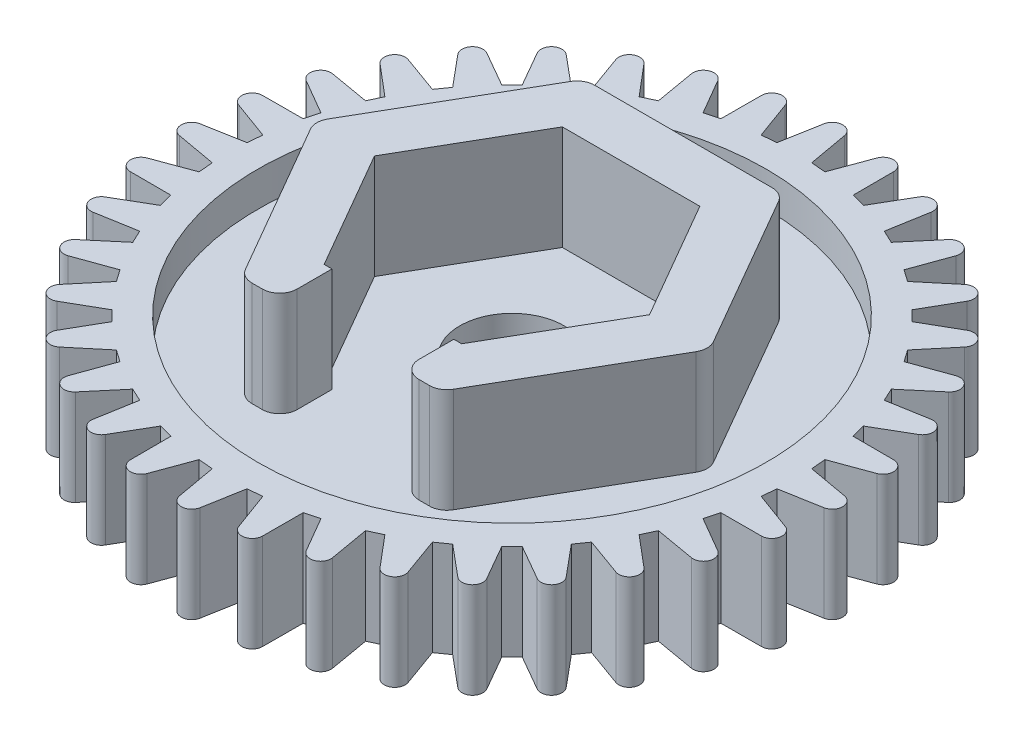
from build123d import *

# Parameters (mm, degrees)
SKETCH2_R           = 13.435028843
CUT_EXTRUDE1_DEPTH  = 2.75
BOSS_EXTRUDE1_DEPTH = 3


with BuildPart() as part:
    # Sketch1 → Revolve1 (revolve)
    with BuildSketch(Plane.XY, mode=Mode.PRIVATE) as revolve1_sk:
        Polygon((1.5, 0), (7.3, 0), (7.3, 1), (9.5, 1), (9.5, -1.75), (7.3, -1.75), (7.3, -2), (1.5, -2), align=None)
    revolve(revolve1_sk.sketch.rotate(Axis((0, 3, 0), (0, -1, 0)), 90), axis=Axis((0, 3, 0), (0, -1, 0)))

    # Sketch2 → Cut-Extrude1 (cut)
    with BuildSketch(Plane(origin=(0, 1, 0), x_dir=(1, 0, 0), z_dir=(0, 1, 0))):
        Circle(SKETCH2_R)
        with BuildLine():
            Line((-0.295304093, 9.252872421), (-0.5, 8.109600792))
            Line((-0.5, 8.109600792), (-0.915813523, 8.073221822))
            Line((-0.915813523, 8.073221822), (-1.315926674, 9.163579516))
            ThreePointArc((-1.315926674, 9.163579516), (-1.649657688, 9.355673654), (-1.897562194, 9.061021481))
            Line((-1.897562194, 9.061021481), (-1.900621276, 7.899573645))
            Line((-1.900621276, 7.899573645), (-2.303800515, 7.791542093))
            Line((-2.303800515, 7.791542093), (-2.887173675, 8.795855883))
            ThreePointArc((-2.887173675, 8.795855883), (-3.249191362, 8.927079897), (-3.442163828, 8.593855987))
            Line((-3.442163828, 8.593855987), (-3.243493135, 7.44952195))
            Line((-3.243493135, 7.44952195), (-3.621787694, 7.2731203))
            Line((-3.621787694, 7.2731203), (-4.370695365, 8.160874621))
            ThreePointArc((-4.370695365, 8.160874621), (-4.75, 8.227241336), (-4.882177057, 7.865570529))
            Line((-4.882177057, 7.865570529), (-4.487813098, 6.7731203))
            Line((-4.487813098, 6.7731203), (-4.829728687, 6.533708427))
            Line((-4.829728687, 6.533708427), (-5.721415687, 7.277929313))
            ThreePointArc((-5.721415687, 7.277929313), (-6.106482292, 7.27742221), (-6.173847806, 6.898293689))
            Line((-6.173847806, 6.898293689), (-5.59577313, 5.890920818))
            Line((-5.59577313, 5.890920818), (-5.890920818, 5.59577313))
            Line((-5.890920818, 5.59577313), (-6.898293689, 6.173847806))
            ThreePointArc((-6.898293689, 6.173847806), (-7.27742221, 6.106482292), (-7.277929313, 5.721415687))
            Line((-7.277929313, 5.721415687), (-6.533708427, 4.829728687))
            Line((-6.533708427, 4.829728687), (-6.7731203, 4.487813098))
            Line((-6.7731203, 4.487813098), (-7.865570529, 4.882177057))
            ThreePointArc((-7.865570529, 4.882177057), (-8.227241336, 4.75), (-8.160874621, 4.370695365))
            Line((-8.160874621, 4.370695365), (-7.2731203, 3.621787694))
            Line((-7.2731203, 3.621787694), (-7.44952195, 3.243493135))
            Line((-7.44952195, 3.243493135), (-8.593855987, 3.442163828))
            ThreePointArc((-8.593855987, 3.442163828), (-8.927079897, 3.249191362), (-8.795855883, 2.887173675))
            Line((-8.795855883, 2.887173675), (-7.791542093, 2.303800515))
            Line((-7.791542093, 2.303800515), (-7.899573645, 1.900621276))
            Line((-7.899573645, 1.900621276), (-9.061021481, 1.897562194))
            ThreePointArc((-9.061021481, 1.897562194), (-9.355673654, 1.649657688), (-9.163579516, 1.315926674))
            Line((-9.163579516, 1.315926674), (-8.073221822, 0.915813523))
            Line((-8.073221822, 0.915813523), (-8.109600792, 0.5))
            Line((-8.109600792, 0.5), (-9.252872421, 0.295304093))
            ThreePointArc((-9.252872421, 0.295304093), (-9.5, 0), (-9.252872421, -0.295304093))
            Line((-9.252872421, -0.295304093), (-8.109600792, -0.5))
            Line((-8.109600792, -0.5), (-8.073221822, -0.915813523))
            Line((-8.073221822, -0.915813523), (-9.163579516, -1.315926674))
            ThreePointArc((-9.163579516, -1.315926674), (-9.355673654, -1.649657688), (-9.061021481, -1.897562194))
            Line((-9.061021481, -1.897562194), (-7.899573645, -1.900621276))
            Line((-7.899573645, -1.900621276), (-7.791542093, -2.303800515))
            Line((-7.791542093, -2.303800515), (-8.795855883, -2.887173675))
            ThreePointArc((-8.795855883, -2.887173675), (-8.927079897, -3.249191362), (-8.593855987, -3.442163828))
            Line((-8.593855987, -3.442163828), (-7.44952195, -3.243493135))
            Line((-7.44952195, -3.243493135), (-7.2731203, -3.621787694))
            Line((-7.2731203, -3.621787694), (-8.160874621, -4.370695365))
            ThreePointArc((-8.160874621, -4.370695365), (-8.227241336, -4.75), (-7.865570529, -4.882177057))
            Line((-7.865570529, -4.882177057), (-6.7731203, -4.487813098))
            Line((-6.7731203, -4.487813098), (-6.533708427, -4.829728687))
            Line((-6.533708427, -4.829728687), (-7.277929313, -5.721415687))
            ThreePointArc((-7.277929313, -5.721415687), (-7.27742221, -6.106482292), (-6.898293689, -6.173847806))
            Line((-6.898293689, -6.173847806), (-5.890920818, -5.59577313))
            Line((-5.890920818, -5.59577313), (-5.59577313, -5.890920818))
            Line((-5.59577313, -5.890920818), (-6.173847806, -6.898293689))
            ThreePointArc((-6.173847806, -6.898293689), (-6.106482292, -7.27742221), (-5.721415687, -7.277929313))
            Line((-5.721415687, -7.277929313), (-4.829728687, -6.533708427))
            Line((-4.829728687, -6.533708427), (-4.487813098, -6.7731203))
            Line((-4.487813098, -6.7731203), (-4.882177057, -7.865570529))
            ThreePointArc((-4.882177057, -7.865570529), (-4.75, -8.227241336), (-4.370695365, -8.160874621))
            Line((-4.370695365, -8.160874621), (-3.621787694, -7.2731203))
            Line((-3.621787694, -7.2731203), (-3.243493135, -7.44952195))
            Line((-3.243493135, -7.44952195), (-3.442163828, -8.593855987))
            ThreePointArc((-3.442163828, -8.593855987), (-3.249191362, -8.927079897), (-2.887173675, -8.795855883))
            Line((-2.887173675, -8.795855883), (-2.303800515, -7.791542093))
            Line((-2.303800515, -7.791542093), (-1.900621276, -7.899573645))
            Line((-1.900621276, -7.899573645), (-1.897562194, -9.061021481))
            ThreePointArc((-1.897562194, -9.061021481), (-1.649657688, -9.355673654), (-1.315926674, -9.163579516))
            Line((-1.315926674, -9.163579516), (-0.915813523, -8.073221822))
            Line((-0.915813523, -8.073221822), (-0.5, -8.109600792))
            Line((-0.5, -8.109600792), (-0.295304093, -9.252872421))
            ThreePointArc((-0.295304093, -9.252872421), (0, -9.5), (0.295304093, -9.252872421))
            Line((0.295304093, -9.252872421), (0.5, -8.109600792))
            Line((0.5, -8.109600792), (0.915813523, -8.073221822))
            Line((0.915813523, -8.073221822), (1.315926674, -9.163579516))
            ThreePointArc((1.315926674, -9.163579516), (1.649657688, -9.355673654), (1.897562194, -9.061021481))
            Line((1.897562194, -9.061021481), (1.900621276, -7.899573645))
            Line((1.900621276, -7.899573645), (2.303800515, -7.791542093))
            Line((2.303800515, -7.791542093), (2.887173675, -8.795855883))
            ThreePointArc((2.887173675, -8.795855883), (3.249191362, -8.927079897), (3.442163828, -8.593855987))
            Line((3.442163828, -8.593855987), (3.243493135, -7.44952195))
            Line((3.243493135, -7.44952195), (3.621787694, -7.2731203))
            Line((3.621787694, -7.2731203), (4.370695365, -8.160874621))
            ThreePointArc((4.370695365, -8.160874621), (4.75, -8.227241336), (4.882177057, -7.865570529))
            Line((4.882177057, -7.865570529), (4.487813098, -6.7731203))
            Line((4.487813098, -6.7731203), (4.829728687, -6.533708427))
            Line((4.829728687, -6.533708427), (5.721415687, -7.277929313))
            ThreePointArc((5.721415687, -7.277929313), (6.106482292, -7.27742221), (6.173847806, -6.898293689))
            Line((6.173847806, -6.898293689), (5.59577313, -5.890920818))
            Line((5.59577313, -5.890920818), (5.890920818, -5.59577313))
            Line((5.890920818, -5.59577313), (6.898293689, -6.173847806))
            ThreePointArc((6.898293689, -6.173847806), (7.27742221, -6.106482292), (7.277929313, -5.721415687))
            Line((7.277929313, -5.721415687), (6.533708427, -4.829728687))
            Line((6.533708427, -4.829728687), (6.7731203, -4.487813098))
            Line((6.7731203, -4.487813098), (7.865570529, -4.882177057))
            ThreePointArc((7.865570529, -4.882177057), (8.227241336, -4.75), (8.160874621, -4.370695365))
            Line((8.160874621, -4.370695365), (7.2731203, -3.621787694))
            Line((7.2731203, -3.621787694), (7.44952195, -3.243493135))
            Line((7.44952195, -3.243493135), (8.593855987, -3.442163828))
            ThreePointArc((8.593855987, -3.442163828), (8.927079897, -3.249191362), (8.795855883, -2.887173675))
            Line((8.795855883, -2.887173675), (7.791542093, -2.303800515))
            Line((7.791542093, -2.303800515), (7.899573645, -1.900621276))
            Line((7.899573645, -1.900621276), (9.061021481, -1.897562194))
            ThreePointArc((9.061021481, -1.897562194), (9.355673654, -1.649657688), (9.163579516, -1.315926674))
            Line((9.163579516, -1.315926674), (8.073221822, -0.915813523))
            Line((8.073221822, -0.915813523), (8.109600792, -0.5))
            Line((8.109600792, -0.5), (9.252872421, -0.295304093))
            ThreePointArc((9.252872421, -0.295304093), (9.5, 0), (9.252872421, 0.295304093))
            Line((9.252872421, 0.295304093), (8.109600792, 0.5))
            Line((8.109600792, 0.5), (8.073221822, 0.915813523))
            Line((8.073221822, 0.915813523), (9.163579516, 1.315926674))
            ThreePointArc((9.163579516, 1.315926674), (9.355673654, 1.649657688), (9.061021481, 1.897562194))
            Line((9.061021481, 1.897562194), (7.899573645, 1.900621276))
            Line((7.899573645, 1.900621276), (7.791542093, 2.303800515))
            Line((7.791542093, 2.303800515), (8.795855883, 2.887173675))
            ThreePointArc((8.795855883, 2.887173675), (8.927079897, 3.249191362), (8.593855987, 3.442163828))
            Line((8.593855987, 3.442163828), (7.44952195, 3.243493135))
            Line((7.44952195, 3.243493135), (7.2731203, 3.621787694))
            Line((7.2731203, 3.621787694), (8.160874621, 4.370695365))
            ThreePointArc((8.160874621, 4.370695365), (8.227241336, 4.75), (7.865570529, 4.882177057))
            Line((7.865570529, 4.882177057), (6.7731203, 4.487813098))
            Line((6.7731203, 4.487813098), (6.533708427, 4.829728687))
            Line((6.533708427, 4.829728687), (7.277929313, 5.721415687))
            ThreePointArc((7.277929313, 5.721415687), (7.27742221, 6.106482292), (6.898293689, 6.173847806))
            Line((6.898293689, 6.173847806), (5.890920818, 5.59577313))
            Line((5.890920818, 5.59577313), (5.59577313, 5.890920818))
            Line((5.59577313, 5.890920818), (6.173847806, 6.898293689))
            ThreePointArc((6.173847806, 6.898293689), (6.106482292, 7.27742221), (5.721415687, 7.277929313))
            Line((5.721415687, 7.277929313), (4.829728687, 6.533708427))
            Line((4.829728687, 6.533708427), (4.487813098, 6.7731203))
            Line((4.487813098, 6.7731203), (4.882177057, 7.865570529))
            ThreePointArc((4.882177057, 7.865570529), (4.75, 8.227241336), (4.370695365, 8.160874621))
            Line((4.370695365, 8.160874621), (3.621787694, 7.2731203))
            Line((3.621787694, 7.2731203), (3.243493135, 7.44952195))
            Line((3.243493135, 7.44952195), (3.442163828, 8.593855987))
            ThreePointArc((3.442163828, 8.593855987), (3.249191362, 8.927079897), (2.887173675, 8.795855883))
            Line((2.887173675, 8.795855883), (2.303800515, 7.791542093))
            Line((2.303800515, 7.791542093), (1.900621276, 7.899573645))
            Line((1.900621276, 7.899573645), (1.897562194, 9.061021481))
            ThreePointArc((1.897562194, 9.061021481), (1.649657688, 9.355673654), (1.315926674, 9.163579516))
            Line((1.315926674, 9.163579516), (0.915813523, 8.073221822))
            Line((0.915813523, 8.073221822), (0.5, 8.109600792))
            Line((0.5, 8.109600792), (0.295304093, 9.252872421))
            ThreePointArc((0.295304093, 9.252872421), (0, 9.5), (-0.295304093, 9.252872421))
        make_face(mode=Mode.SUBTRACT)
    extrude(amount=-CUT_EXTRUDE1_DEPTH, mode=Mode.SUBTRACT)

    # Sketch3 → Boss-Extrude1 (add)
    with BuildSketch(Plane(origin=(0, 0, 0), x_dir=(1, 0, 0), z_dir=(0, 1, 0))):
        with BuildLine():
            Line((-3.95, 0), (-1.975, -3.420800345))
            Line((-1.975, -3.420800345), (-1.75, -3.420800345))
            Line((-1.75, -3.420800345), (-1.75, -4.420800345))
            ThreePointArc((-1.75, -4.420800345), (-1.896446609, -4.774353736), (-2.25, -4.920800345))
            Line((-2.25, -4.920800345), (-2.552350269, -4.920800345))
            ThreePointArc((-2.552350269, -4.920800345), (-2.802350269, -4.853813047), (-2.985362971, -4.670800345))
            Line((-2.985362971, -4.670800345), (-5.53771324, -0.25))
            ThreePointArc((-5.53771324, -0.25), (-5.604700538, 0), (-5.53771324, 0.25))
            Line((-5.53771324, 0.25), (-2.985362971, 4.670800345))
            ThreePointArc((-2.985362971, 4.670800345), (-2.802350269, 4.853813047), (-2.552350269, 4.920800345))
            Line((-2.552350269, 4.920800345), (2.552350269, 4.920800345))
            ThreePointArc((2.552350269, 4.920800345), (2.802350269, 4.853813047), (2.985362971, 4.670800345))
            Line((2.985362971, 4.670800345), (5.53771324, 0.25))
            ThreePointArc((5.53771324, 0.25), (5.604700538, 0), (5.53771324, -0.25))
            Line((5.53771324, -0.25), (2.985362971, -4.670800345))
            ThreePointArc((2.985362971, -4.670800345), (2.802350269, -4.853813047), (2.552350269, -4.920800345))
            Line((2.552350269, -4.920800345), (2.25, -4.920800345))
            ThreePointArc((2.25, -4.920800345), (1.896446609, -4.774353736), (1.75, -4.420800345))
            Line((1.75, -4.420800345), (1.75, -3.420800345))
            Line((1.75, -3.420800345), (1.975, -3.420800345))
            Line((1.975, -3.420800345), (3.95, 0))
            Line((3.95, 0), (1.975, 3.420800345))
            Line((1.975, 3.420800345), (-1.975, 3.420800345))
            Line((-1.975, 3.420800345), (-3.95, 0))
        make_face()
    extrude(amount=BOSS_EXTRUDE1_DEPTH)


solid = part.part
